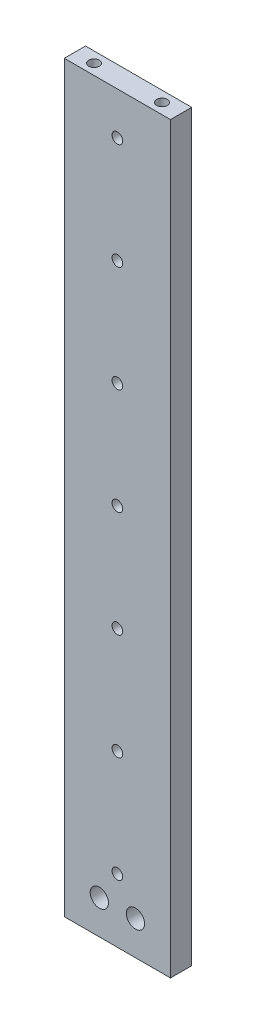
from build123d import *

# Parameters (mm, degrees)
AUFSATZ_LINEAR_AUSTRAGEN1_DEPTH      = 12.5
AUFSATZ_LINEAR_AUSTRAGEN1_DEPTH_BACK = 12.5
SKIZZE1_W                            = 5
SKIZZE1_H                            = 175
M3_GEWINDEBOHRUNG3_D                 = 2.5
M3_GEWINDEBOHRUNG1_D                 = 2.5
M3_GEWINDEBOHRUNG1_DEPTH             = 8.5
M3_GEWINDEBOHRUNG1_TIP               = 0.751075774
M3_GEWINDEBOHRUNG2_D                 = 2.5
M3_GEWINDEBOHRUNG2_DEPTH             = 8.5
M3_GEWINDEBOHRUNG2_TIP               = 0.751075774
DURCHGANGSLOCH_F_R_M41_D             = 4.3


with BuildPart() as part:
    # Skizze1 → Aufsatz-Linear austragen1 (new, two sides: drawn at the far end of the back side and taken through both)
    with BuildSketch(Plane(origin=(0, 0, 0), x_dir=(0, 0, -1), z_dir=(1, 0, 0)).offset(-AUFSATZ_LINEAR_AUSTRAGEN1_DEPTH_BACK)):
        with Locations((2.5, 87.5)):
            Rectangle(SKIZZE1_W, SKIZZE1_H)
    extrude(amount=AUFSATZ_LINEAR_AUSTRAGEN1_DEPTH + AUFSATZ_LINEAR_AUSTRAGEN1_DEPTH_BACK)

    # M3 Gewindebohrung3 (through all)
    with Locations(Plane(origin=(0, 0, -5), x_dir=(-1, 0, 0), z_dir=(0, 0, -1))):
        with Locations((0, 15), (0, 165), (0, 140), (0, 115), (0, 90), (0, 65), (0, 40)):
            Hole(M3_GEWINDEBOHRUNG3_D / 2)

    # M3 Gewindebohrung1
    with Locations(Plane(origin=(0, 175, 0), x_dir=(1, 0, 0), z_dir=(0, 1, 0))):
        with Locations((8, 2.5), (-8, 2.5)):
            Hole(M3_GEWINDEBOHRUNG1_D / 2, depth=M3_GEWINDEBOHRUNG1_DEPTH)
            with Locations((0, 0, -(M3_GEWINDEBOHRUNG1_DEPTH + M3_GEWINDEBOHRUNG1_TIP / 2))):  # 118° drill point
                Cone(0, M3_GEWINDEBOHRUNG1_D / 2, M3_GEWINDEBOHRUNG1_TIP, mode=Mode.SUBTRACT)

    # M3 Gewindebohrung2
    with Locations(Plane(origin=(0, 0, 0), x_dir=(-1, 0, 0), z_dir=(0, -1, 0))):
        with Locations((8, 2.5), (-8, 2.5)):
            Hole(M3_GEWINDEBOHRUNG2_D / 2, depth=M3_GEWINDEBOHRUNG2_DEPTH)
            with Locations((0, 0, -(M3_GEWINDEBOHRUNG2_DEPTH + M3_GEWINDEBOHRUNG2_TIP / 2))):  # 118° drill point
                Cone(0, M3_GEWINDEBOHRUNG2_D / 2, M3_GEWINDEBOHRUNG2_TIP, mode=Mode.SUBTRACT)

    # Durchgangsloch für M41 (through all)
    with Locations(Plane(origin=(0, 0, -5), x_dir=(-1, 0, 0), z_dir=(0, 0, -1))):
        with Locations((-4.25, 8), (4.25, 8)):
            Hole(DURCHGANGSLOCH_F_R_M41_D / 2)


solid = part.part
